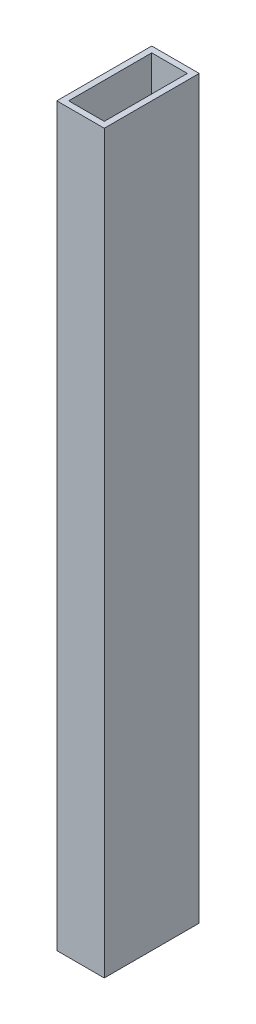
from build123d import *

# Parameters (mm, degrees)
SKETCH1_W           = 25.4
SKETCH1_H           = 50.8
SKETCH1_W_2         = 19.05
SKETCH1_H_2         = 44.45
BOSS_EXTRUDE1_DEPTH = 393.7


with BuildPart() as part:
    # Sketch1 → Boss-Extrude1 (new body)
    with BuildSketch(Plane(origin=(0, 0, 0), x_dir=(1, 0, 0), z_dir=(0, 1, 0))):
        Rectangle(SKETCH1_W, SKETCH1_H)
        Rectangle(SKETCH1_W_2, SKETCH1_H_2, mode=Mode.SUBTRACT)
    extrude(amount=BOSS_EXTRUDE1_DEPTH)


solid = part.part
